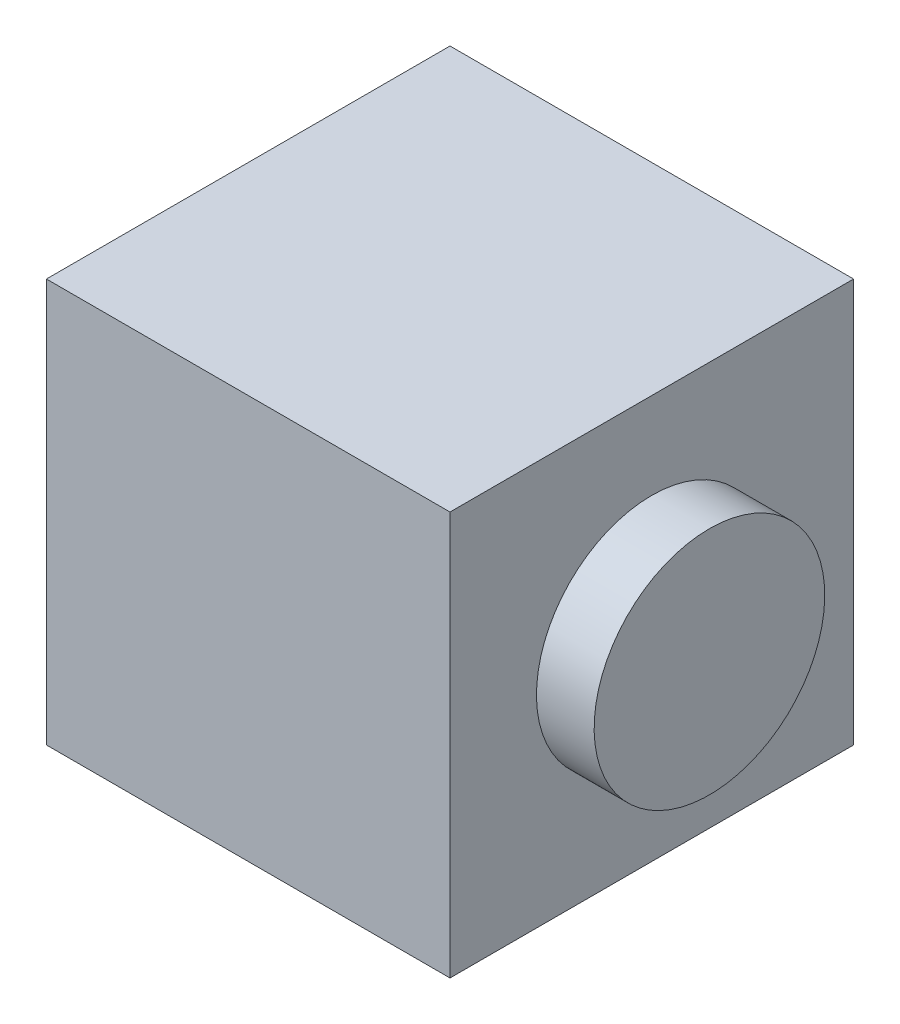
from build123d import *

# Parameters (mm, degrees)
CROQUIS1_W              = 70
CROQUIS1_H              = 70
SALIENTE_EXTRUIR1_DEPTH = 70
CROQUIS2_R              = 20
SALIENTE_EXTRUIR2_DEPTH = 10
CROQUIS3_R              = 20
CORTAR_EXTRUIR1_DEPTH   = 10


with BuildPart() as part:
    # Croquis1 → Saliente-Extruir1 (new body)
    with BuildSketch(Plane.XY):
        with Locations((35, 35)):
            Rectangle(CROQUIS1_W, CROQUIS1_H)
    extrude(amount=SALIENTE_EXTRUIR1_DEPTH)

    # Croquis2 → Saliente-Extruir2 (add)
    with BuildSketch(Plane(origin=(70, 0, 0), x_dir=(0, 0, -1), z_dir=(1, 0, 0))):
        with Locations(Location((-35, 35, 0), (0, 0, 90))):
            Circle(CROQUIS2_R)
    extrude(amount=SALIENTE_EXTRUIR2_DEPTH)

    # Croquis3 → Cortar-Extruir1 (cut)
    with BuildSketch(Plane(origin=(0, 0, 0), x_dir=(-1, 0, 0), z_dir=(0, 0, -1))):
        with Locations((-35, 35)):
            Circle(CROQUIS3_R)
    extrude(amount=-CORTAR_EXTRUIR1_DEPTH, mode=Mode.SUBTRACT)


solid = part.part
